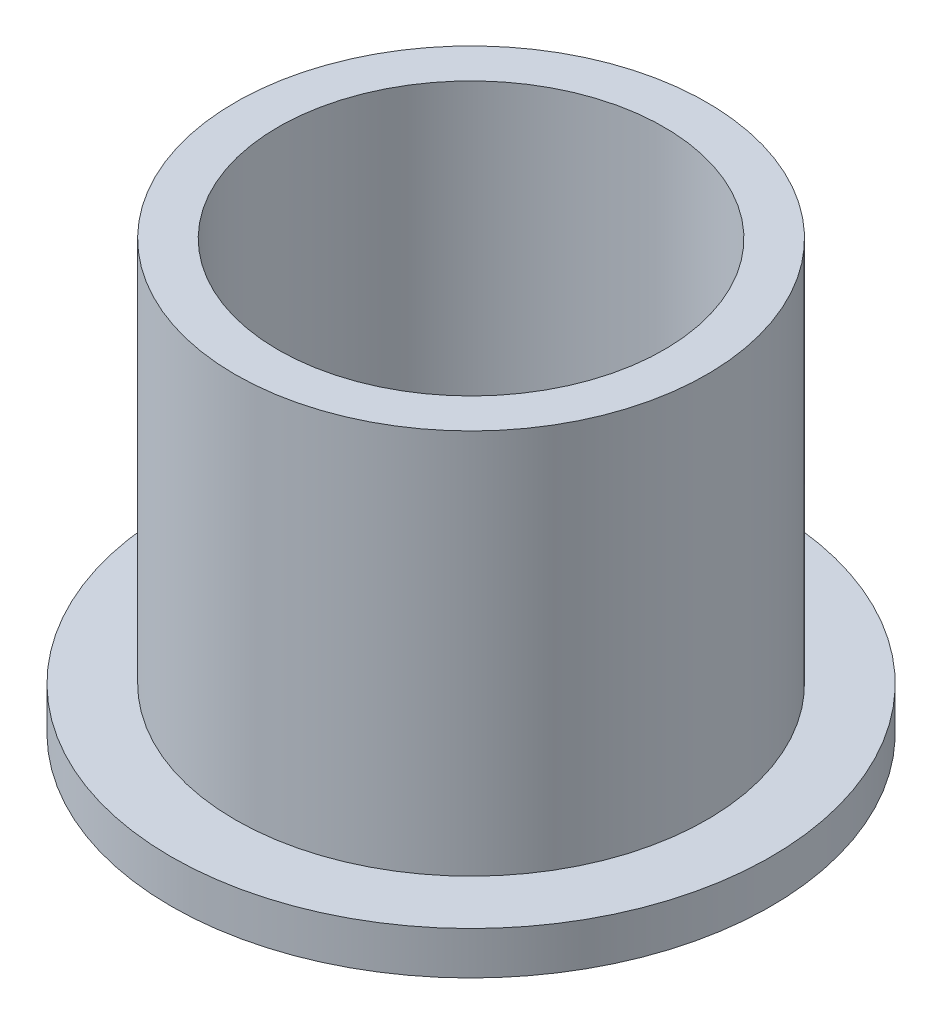
from build123d import *

# Parameters (mm, degrees)
SKETCH2_R           = 17.4752
SKETCH2_R_2         = 14.3002
BOSS_EXTRUDE1_DEPTH = 31.75
SKETCH3_R           = 22.225
SKETCH3_R_2         = 17.4752
BOSS_EXTRUDE2_DEPTH = 3.175


with BuildPart() as part:
    # Sketch2 → Boss-Extrude1 (new body)
    with BuildSketch(Plane(origin=(0, 0, 0), x_dir=(1, 0, 0), z_dir=(0, 1, 0))):
        with Locations(Location((0, 0, 0), (0, 0, 270))):
            Circle(SKETCH2_R)
        with Locations(Location((0, 0, 0), (0, 0, 270))):
            Circle(SKETCH2_R_2, mode=Mode.SUBTRACT)
    extrude(amount=BOSS_EXTRUDE1_DEPTH)

    # Sketch3 → Boss-Extrude2 (add)
    with BuildSketch(Plane(origin=(0, 0, 0), x_dir=(1, 0, 0), z_dir=(0, 1, 0))):
        with Locations(Location((0, 0, 0), (0, 0, 270))):
            Circle(SKETCH3_R)
        with Locations(Location((0, 0, 0), (0, 0, 270))):
            Circle(SKETCH3_R_2, mode=Mode.SUBTRACT)
    extrude(amount=BOSS_EXTRUDE2_DEPTH)


solid = part.part
